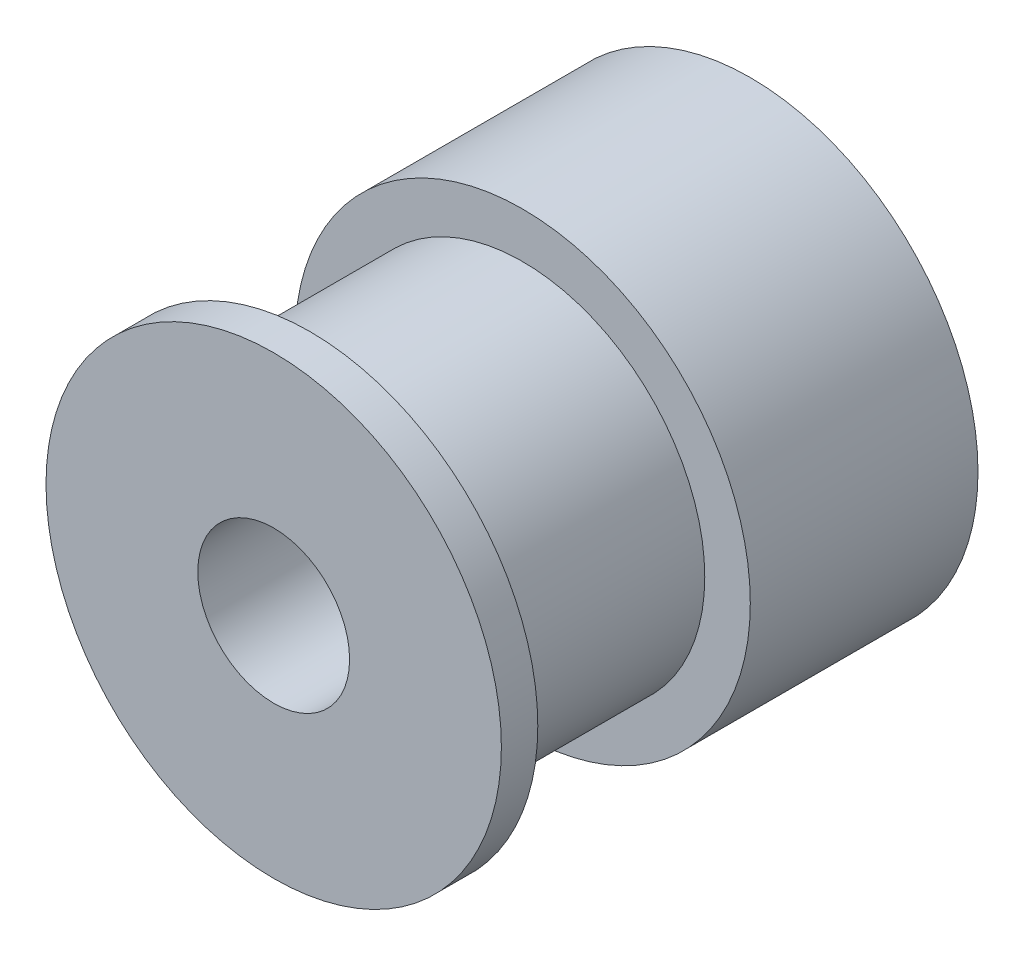
from build123d import *

# Parameters (mm, degrees)
ESQUISSE1_R             = 7.5
BOSS_EXTRU_1_DEPTH      = 7.5
ESQUISSE2_R             = 6
BOSS_EXTRU_2_DEPTH      = 7
ESQUISSE3_R             = 7.5
BOSS_EXTRU_3_DEPTH      = 1.2
ESQUISSE4_R             = 2.5
ENL_V_MAT_EXTRU_1_DEPTH = 30


with BuildPart() as part:
    # Esquisse1 → Boss.-Extru.1 (new body)
    with BuildSketch(Plane.XY):
        Circle(ESQUISSE1_R)
    extrude(amount=BOSS_EXTRU_1_DEPTH)

    # Esquisse2 → Boss.-Extru.2 (add)
    with BuildSketch(Plane.XY.offset(7.5)):
        Circle(ESQUISSE2_R)
    extrude(amount=BOSS_EXTRU_2_DEPTH)

    # Esquisse3 → Boss.-Extru.3 (add)
    with BuildSketch(Plane.XY.offset(14.5)):
        Circle(ESQUISSE3_R)
    extrude(amount=BOSS_EXTRU_3_DEPTH)

    # Esquisse4 → Enlèv. mat.-Extru.1 (cut)
    with BuildSketch(Plane(origin=(0, 0, 0), x_dir=(-1, 0, 0), z_dir=(0, 0, -1))):
        Circle(ESQUISSE4_R)
    extrude(amount=-ENL_V_MAT_EXTRU_1_DEPTH, mode=Mode.SUBTRACT)


solid = part.part
